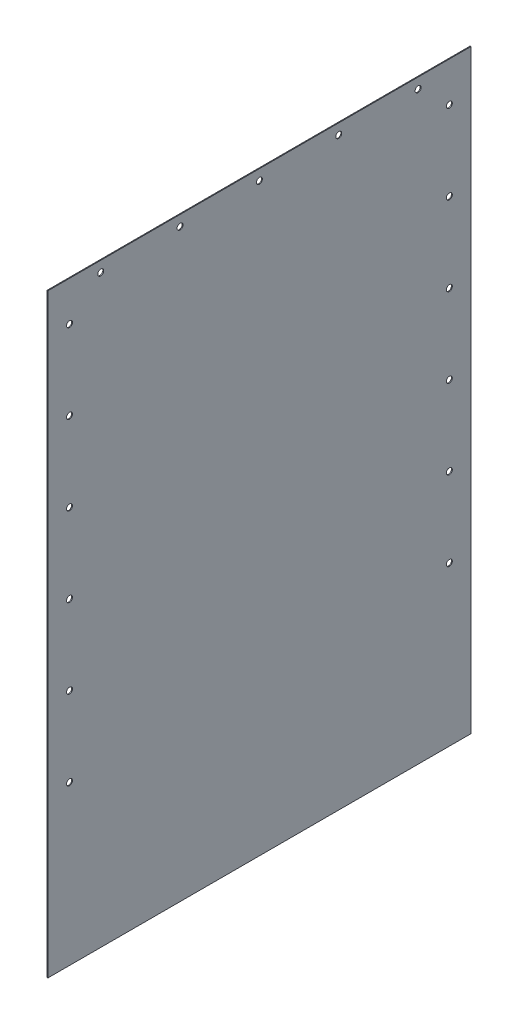
from build123d import *

# Parameters (mm, degrees)
SKETCH1_W               = 320
SKETCH1_H               = 450
BOSS_EXTRUDE1_DEPTH     = 0.635
SKETCH2_R               = 2.248
CUT_EXTRUDE1_DEPTH      = 384.603759083
LPATTERN1_COUNT         = 6
LPATTERN1_PITCH         = 60
MIRROR2_COPY_1_SKETCH_R = 2.248
MIRROR2_COPY_1_DEPTH    = 384.603759083
MIRROR2_COPY_2_SKETCH_R = 2.248
MIRROR2_COPY_2_DEPTH    = 384.603759083
MIRROR2_COPY_3_SKETCH_R = 2.248
MIRROR2_COPY_3_DEPTH    = 384.603759083
MIRROR2_COPY_4_SKETCH_R = 2.248
MIRROR2_COPY_4_DEPTH    = 384.603759083
MIRROR2_COPY_5_SKETCH_R = 2.248
MIRROR2_COPY_5_DEPTH    = 384.603759083
MIRROR2_COPY_6_SKETCH_R = 2.248
MIRROR2_COPY_6_DEPTH    = 384.603759083
SKETCH3_R               = 2.248
CUT_EXTRUDE2_DEPTH      = 384.603759083
LPATTERN2_COUNT         = 5
LPATTERN2_PITCH         = 60


with BuildPart() as part:
    # Sketch1 → Boss-Extrude1 (new body)
    with BuildSketch(Plane(origin=(0, 0, 0), x_dir=(0, 0, -1), z_dir=(1, 0, 0))):
        with Locations((18.924731183, -114.318996416)):
            Rectangle(SKETCH1_W, SKETCH1_H)
    extrude(amount=BOSS_EXTRUDE1_DEPTH)

    # Sketch2 → Cut-Extrude1 (cut, through all)
    with BuildSketch(Plane(origin=(0, 0, 0), x_dir=(0, 0, -1), z_dir=(1, 0, 0))):
        with Locations((-124.675268817, 80.681003584)):
            Circle(SKETCH2_R)
    cut_extrude1 = extrude(amount=CUT_EXTRUDE1_DEPTH, mode=Mode.SUBTRACT)

    # LPattern1: Cut-Extrude1 ×6
    with Locations(*[(0, -i * LPATTERN1_PITCH, 0) for i in range(1, LPATTERN1_COUNT)]):
        add(cut_extrude1, mode=Mode.SUBTRACT)

    # Mirror2 copy 1 sketch → Mirror2 copy 1 (cut, through all)
    with BuildSketch(Plane(origin=(0, -60, -37.849462366), x_dir=(0, 0, 1), z_dir=(1, 0, 0))):
        with Locations((-124.675268817, -80.681003584)):
            Circle(MIRROR2_COPY_1_SKETCH_R)
    extrude(amount=MIRROR2_COPY_1_DEPTH, mode=Mode.SUBTRACT)

    # Mirror2 copy 2 sketch → Mirror2 copy 2 (cut, through all)
    with BuildSketch(Plane(origin=(0, -120, -37.849462366), x_dir=(0, 0, 1), z_dir=(1, 0, 0))):
        with Locations((-124.675268817, -80.681003584)):
            Circle(MIRROR2_COPY_2_SKETCH_R)
    extrude(amount=MIRROR2_COPY_2_DEPTH, mode=Mode.SUBTRACT)

    # Mirror2 copy 3 sketch → Mirror2 copy 3 (cut, through all)
    with BuildSketch(Plane(origin=(0, -180, -37.849462366), x_dir=(0, 0, 1), z_dir=(1, 0, 0))):
        with Locations((-124.675268817, -80.681003584)):
            Circle(MIRROR2_COPY_3_SKETCH_R)
    extrude(amount=MIRROR2_COPY_3_DEPTH, mode=Mode.SUBTRACT)

    # Mirror2 copy 4 sketch → Mirror2 copy 4 (cut, through all)
    with BuildSketch(Plane(origin=(0, -240, -37.849462366), x_dir=(0, 0, 1), z_dir=(1, 0, 0))):
        with Locations((-124.675268817, -80.681003584)):
            Circle(MIRROR2_COPY_4_SKETCH_R)
    extrude(amount=MIRROR2_COPY_4_DEPTH, mode=Mode.SUBTRACT)

    # Mirror2 copy 5 sketch → Mirror2 copy 5 (cut, through all)
    with BuildSketch(Plane(origin=(0, -300, -37.849462366), x_dir=(0, 0, 1), z_dir=(1, 0, 0))):
        with Locations((-124.675268817, -80.681003584)):
            Circle(MIRROR2_COPY_5_SKETCH_R)
    extrude(amount=MIRROR2_COPY_5_DEPTH, mode=Mode.SUBTRACT)

    # Mirror2 copy 6 sketch → Mirror2 copy 6 (cut, through all)
    with BuildSketch(Plane(origin=(0, 0, -37.849462366), x_dir=(0, 0, 1), z_dir=(1, 0, 0))):
        with Locations((-124.675268817, -80.681003584)):
            Circle(MIRROR2_COPY_6_SKETCH_R)
    extrude(amount=MIRROR2_COPY_6_DEPTH, mode=Mode.SUBTRACT)

    # Sketch3 → Cut-Extrude2 (cut, through all)
    with BuildSketch(Plane.ZY):
        with Locations((-138.924731183, 102.706003584)):
            Circle(SKETCH3_R)
    cut_extrude2 = extrude(amount=-CUT_EXTRUDE2_DEPTH, mode=Mode.SUBTRACT)

    # LPattern2: Cut-Extrude2 ×5
    with Locations(*[(0, 0, i * LPATTERN2_PITCH) for i in range(1, LPATTERN2_COUNT)]):
        add(cut_extrude2, mode=Mode.SUBTRACT)


solid = part.part
